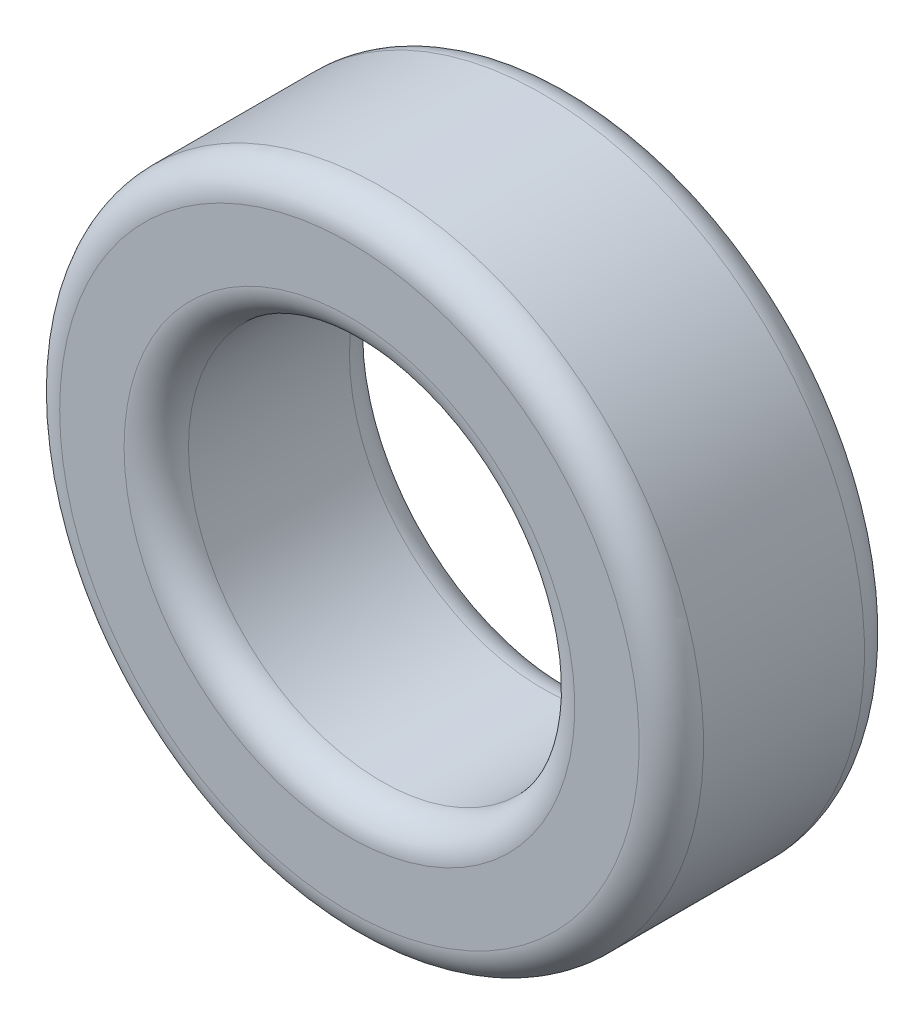
from build123d import *


with BuildPart() as part:
    # Esboço1 → Revolução1 (revolve)
    with BuildSketch(Plane(origin=(0, 0, 0), x_dir=(0, 0, -1), z_dir=(1, 0, 0)), mode=Mode.PRIVATE) as revolu_o1_sk:
        with BuildLine():
            Line((-1.25, 5), (1.25, 5))
            ThreePointArc((1.25, 5), (1.603553391, 4.853553391), (1.75, 4.5))
            Line((1.75, 4.5), (1.75, 3.5))
            ThreePointArc((1.75, 3.5), (1.603553391, 3.146446609), (1.25, 3))
            Line((1.25, 3), (-1.25, 3))
            ThreePointArc((-1.25, 3), (-1.603553391, 3.146446609), (-1.75, 3.5))
            Line((-1.75, 3.5), (-1.75, 4.5))
            ThreePointArc((-1.75, 4.5), (-1.603553391, 4.853553391), (-1.25, 5))
        make_face()
    revolve(revolu_o1_sk.sketch.rotate(Axis((0, 0, 0), (0, 0, 1)), 90), axis=Axis((0, 0, 0), (0, 0, 1)))


solid = part.part
